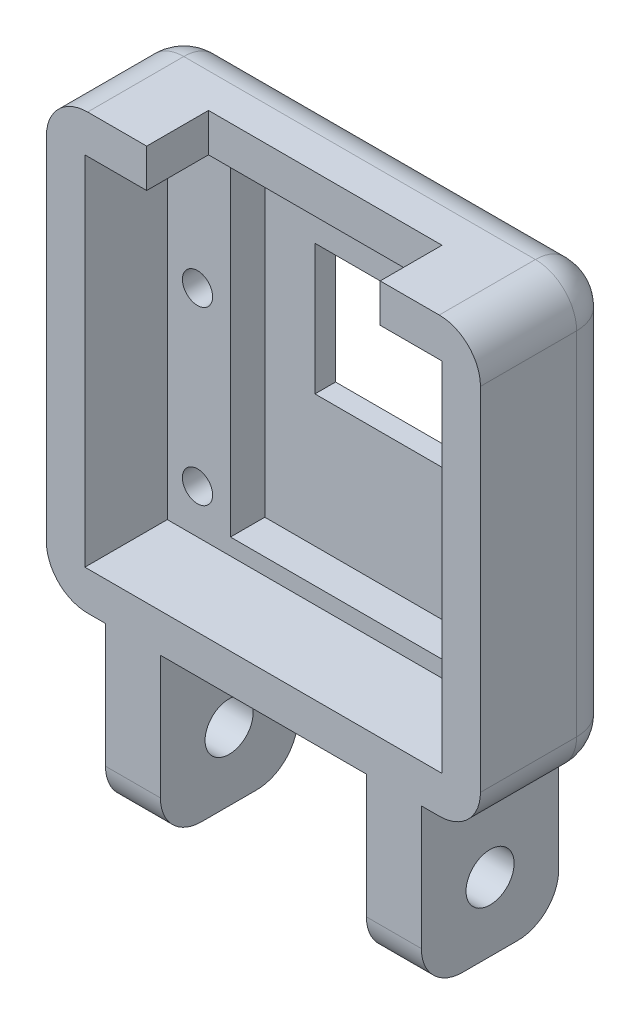
from build123d import *

# Parameters (mm, degrees)
SKETCH2_W           = 31.6
SKETCH2_H           = 31.6
BOSS_EXTRUDE1_DEPTH = 10
SKETCH13_W          = 4
SKETCH13_H          = 10
BOSS_EXTRUDE2_DEPTH = 12
SKETCH14_R          = 1.75
CUT_EXTRUDE5_DEPTH  = 30
SKETCH9_W           = 25.999998474
SKETCH9_H           = 25.999998474
CUT_EXTRUDE1_DEPTH  = 6
SKETCH10_W          = 16.8
SKETCH10_H          = 23.599998474
CUT_EXTRUDE2_DEPTH  = 2.5
SKETCH11_W          = 9.5
SKETCH11_H          = 9.5
CUT_EXTRUDE3_DEPTH  = 2.5
SKETCH12_R          = 1.1
CUT_EXTRUDE4_DEPTH  = 3
FILLET1_R           = 3
SKETCH15_W          = 17
SKETCH15_H          = 2.800000763
CUT_EXTRUDE6_DEPTH  = 4.5


with BuildPart() as part:
    # Sketch2 → Boss-Extrude1 (new body)
    with BuildSketch(Plane.XY):
        Rectangle(SKETCH2_W, SKETCH2_H)
    extrude(amount=BOSS_EXTRUDE1_DEPTH)

    # Sketch13 → Boss-Extrude2 (add)
    with BuildSketch(Plane.XZ.offset(15.8)):
        with Locations((-9.5, 5)):
            Rectangle(SKETCH13_W, SKETCH13_H)
        with Locations((9.5, 5)):
            Rectangle(SKETCH13_W, SKETCH13_H)
    extrude(amount=BOSS_EXTRUDE2_DEPTH)

    # Sketch14 → Cut-Extrude5 (cut)
    with BuildSketch(Plane.ZY.offset(11.5)):
        with Locations(Location((5, -22.8, 0), (0, 0, 270))):
            Circle(SKETCH14_R)
    extrude(amount=-CUT_EXTRUDE5_DEPTH, mode=Mode.SUBTRACT)

    # Sketch9 → Cut-Extrude1 (cut)
    with BuildSketch(Plane.XY.offset(10)):
        Rectangle(SKETCH9_W, SKETCH9_H)
    extrude(amount=-CUT_EXTRUDE1_DEPTH, mode=Mode.SUBTRACT)

    # Sketch10 → Cut-Extrude2 (cut)
    with BuildSketch(Plane.XY.offset(4)):
        Rectangle(SKETCH10_W, SKETCH10_H)
    extrude(amount=-CUT_EXTRUDE2_DEPTH, mode=Mode.SUBTRACT)

    # Sketch11 → Cut-Extrude3 (cut)
    with BuildSketch(Plane.XY.offset(1.5)):
        with Locations((0, 2.549999952)):
            Rectangle(SKETCH11_W, SKETCH11_H)
    extrude(amount=-CUT_EXTRUDE3_DEPTH, mode=Mode.SUBTRACT)

    # Sketch12 → Cut-Extrude4 (cut)
    with BuildSketch(Plane.XY.offset(4)):
        with Locations((-10.800000191, 2.700000048)):
            Circle(SKETCH12_R)
        with Locations((10.800000191, 2.700000048)):
            Circle(SKETCH12_R)
        with Locations((10.800000191, -9.800000191)):
            Circle(SKETCH12_R)
        with Locations((-10.800000191, -9.800000191)):
            Circle(SKETCH12_R)
    extrude(amount=-CUT_EXTRUDE4_DEPTH, mode=Mode.SUBTRACT)

    # Fillet1
    fillet1_edges = [part.edges().sort_by_distance(p)[0] for p in [
        (0, -15.8, 0),
        (-9.5, -27.8, 0),
        (-9.5, -27.8, 10),
        (13.65, -15.8, 0),
        (9.5, -27.8, 0),
        (9.5, -27.8, 10),
        (0, 15.8, 0),
        (15.8, 0, 0),
        (-13.65, -15.8, 0),
        (-15.8, 0, 0),
        (-15.8, 15.8, 5),
        (15.8, 15.8, 5),
        (15.8, -15.8, 5),
        (-15.8, -15.8, 5),
    ]]
    fillet(fillet1_edges, radius=FILLET1_R)

    # Sketch15 → Cut-Extrude6 (cut)
    with BuildSketch(Plane.XY.offset(10)):
        with Locations((0, 14.399999619)):
            Rectangle(SKETCH15_W, SKETCH15_H)
    extrude(amount=-CUT_EXTRUDE6_DEPTH, mode=Mode.SUBTRACT)


solid = part.part
